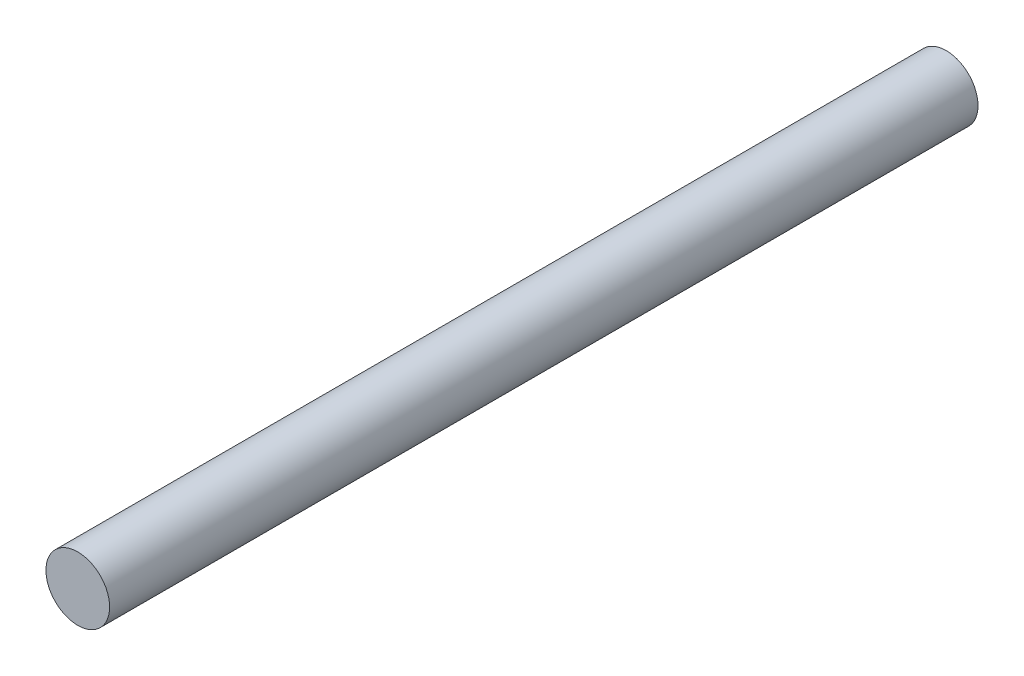
from build123d import *

# Parameters (mm, degrees)
SKETCH1_R           = 12.65
BOSS_EXTRUDE1_DEPTH = 345


with BuildPart() as part:
    # Sketch1 → Boss-Extrude1 (new body)
    with BuildSketch(Plane.XY):
        Circle(SKETCH1_R)
    extrude(amount=-BOSS_EXTRUDE1_DEPTH)


solid = part.part
